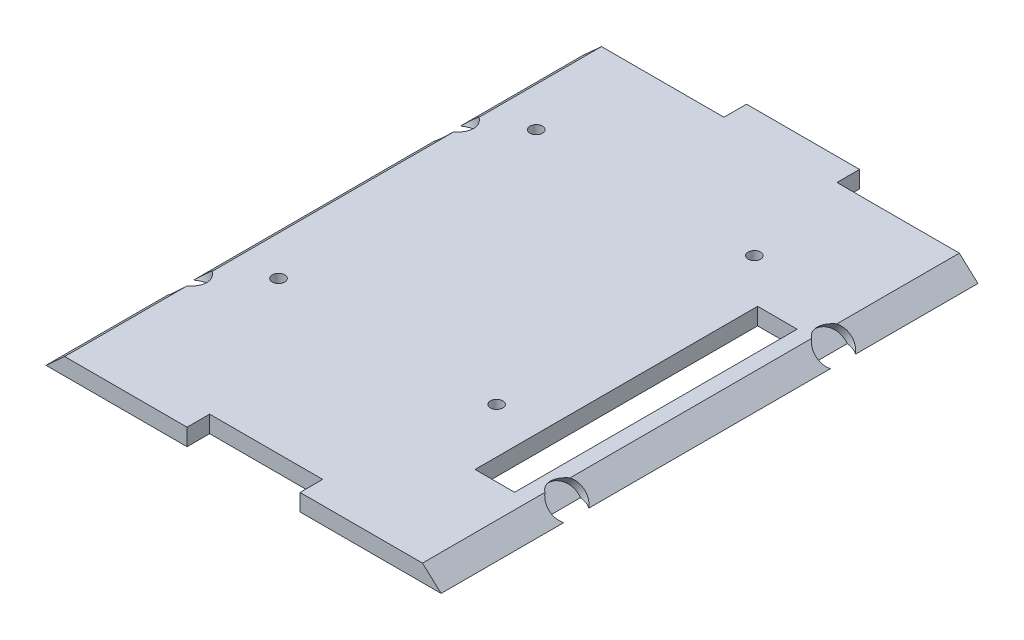
from build123d import *

# Parameters (mm, degrees)
BOSS_EXTRUDE1_DEPTH = 120.65
SKETCH2_R           = 1.397
CUT_EXTRUDE1_DEPTH  = 129.616537105
SKETCH3_W           = 25.4
SKETCH3_H           = 5.08
CUT_EXTRUDE2_DEPTH  = 129.616537105
SKETCH5_W           = 25.4
SKETCH5_H           = 10.16
BOSS_EXTRUDE3_DEPTH = 3.81
SKETCH6_W           = 8.89
SKETCH6_H           = 63.5
CUT_EXTRUDE3_DEPTH  = 129.616537105
SKETCH7_R           = 4
CUT_EXTRUDE4_DEPTH  = 2
SKETCH8_R           = 4
CUT_EXTRUDE5_DEPTH  = 2


with BuildPart() as part:
    # Sketch1 → Boss-Extrude1 (new body)
    with BuildSketch(Plane.XY):
        Polygon((-40.203883769, 5.937788296), (40.203883769, 5.937788296), (44.399042974, 2.127788296), (-44.399042974, 2.127788296), align=None)
    extrude(amount=BOSS_EXTRUDE1_DEPTH)

    # Sketch2 → Cut-Extrude1 (cut, through all)
    with BuildSketch(Plane.XZ.offset(-2.127788296)):
        with Locations(Location((-31.369, 81.429995649, 0), (0, 0, 270))):
            Circle(SKETCH2_R)
        with Locations(Location((17.653, 23.517995649, 0), (0, 0, 270))):
            Circle(SKETCH2_R)
        with Locations(Location((-31.369, 23.517995649, 0), (0, 0, 270))):
            Circle(SKETCH2_R)
        with Locations(Location((17.653, 81.429995649, 0), (0, 0, 270))):
            Circle(SKETCH2_R)
    extrude(amount=-CUT_EXTRUDE1_DEPTH, mode=Mode.SUBTRACT)

    # Sketch3 → Cut-Extrude2 (cut, through all)
    with BuildSketch(Plane.XZ.offset(-2.127788296)):
        with Locations((0, 118.11)):
            Rectangle(SKETCH3_W, SKETCH3_H)
        with Locations((0, 2.54)):
            Rectangle(SKETCH3_W, SKETCH3_H)
    extrude(amount=-CUT_EXTRUDE2_DEPTH, mode=Mode.SUBTRACT)

    # Sketch5 → Boss-Extrude3 (add)
    with BuildSketch(Plane.XZ.offset(-2.127788296)):
        Rectangle(SKETCH5_W, SKETCH5_H)
    extrude(amount=-BOSS_EXTRUDE3_DEPTH)

    # Sketch6 → Cut-Extrude3 (cut, through all)
    with BuildSketch(Plane.XZ.offset(-2.127788296)):
        with Locations((32.334042974, 64.77)):
            Rectangle(SKETCH6_W, SKETCH6_H)
    extrude(amount=-CUT_EXTRUDE3_DEPTH, mode=Mode.SUBTRACT)

    # Sketch7 → Cut-Extrude4 (cut)
    with BuildSketch(Plane(origin=(21.127225221, 23.263011377, 0), x_dir=(0.7402720771062566, -0.6723074087475077, 0), z_dir=(0.6723074087475077, 0.7402720771062566, 0))):
        with Locations((28.603318705, -90.297)):
            Circle(SKETCH7_R)
        with Locations((28.603318705, -30.353)):
            Circle(SKETCH7_R)
    extrude(amount=-CUT_EXTRUDE4_DEPTH, mode=Mode.SUBTRACT)

    # Sketch8 → Cut-Extrude5 (cut)
    with BuildSketch(Plane(origin=(-21.127225221, 23.263011377, 0), x_dir=(0.7402720771062566, 0.6723074087475077, 0), z_dir=(-0.6723074087475077, 0.7402720771062566, 0))):
        with Locations((-28.603318705, -30.353)):
            Circle(SKETCH8_R)
        with Locations((-28.603318705, -90.297)):
            Circle(SKETCH8_R)
    extrude(amount=-CUT_EXTRUDE5_DEPTH, mode=Mode.SUBTRACT)


solid = part.part
